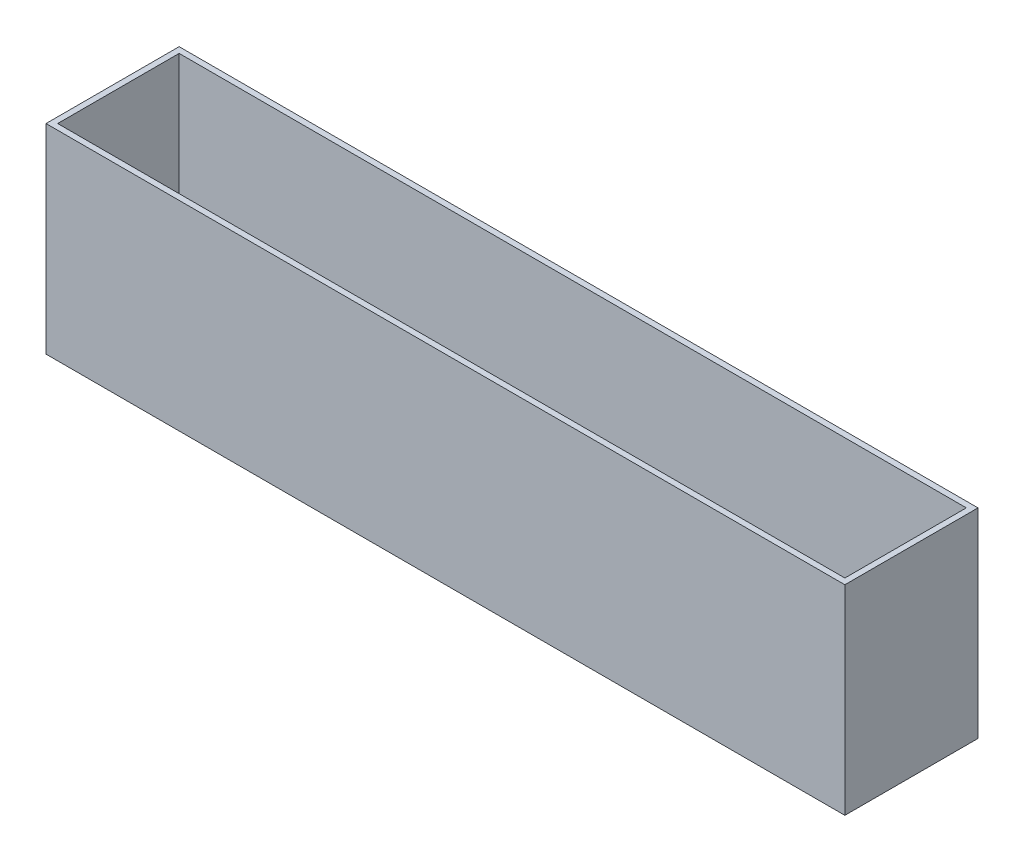
from build123d import *

# Parameters (mm, degrees)
SKETCH1_W           = 1200
SKETCH1_H           = 200
BOSS_EXTRUDE1_DEPTH = 300
SKETCH2_W           = 1182.474
SKETCH2_H           = 182.474
CUT_EXTRUDE1_DEPTH  = 291.237


with BuildPart() as part:
    # Sketch1 → Boss-Extrude1 (new body)
    with BuildSketch(Plane(origin=(0, 0, 0), x_dir=(1, 0, 0), z_dir=(0, 1, 0))):
        with Locations((600, 100)):
            Rectangle(SKETCH1_W, SKETCH1_H)
    extrude(amount=BOSS_EXTRUDE1_DEPTH)

    # Sketch2 → Cut-Extrude1 (cut)
    with BuildSketch(Plane(origin=(0, 300, 0), x_dir=(1, 0, 0), z_dir=(0, 1, 0))):
        with Locations((600, 100)):
            Rectangle(SKETCH2_W, SKETCH2_H)
    extrude(amount=-CUT_EXTRUDE1_DEPTH, mode=Mode.SUBTRACT)


solid = part.part
